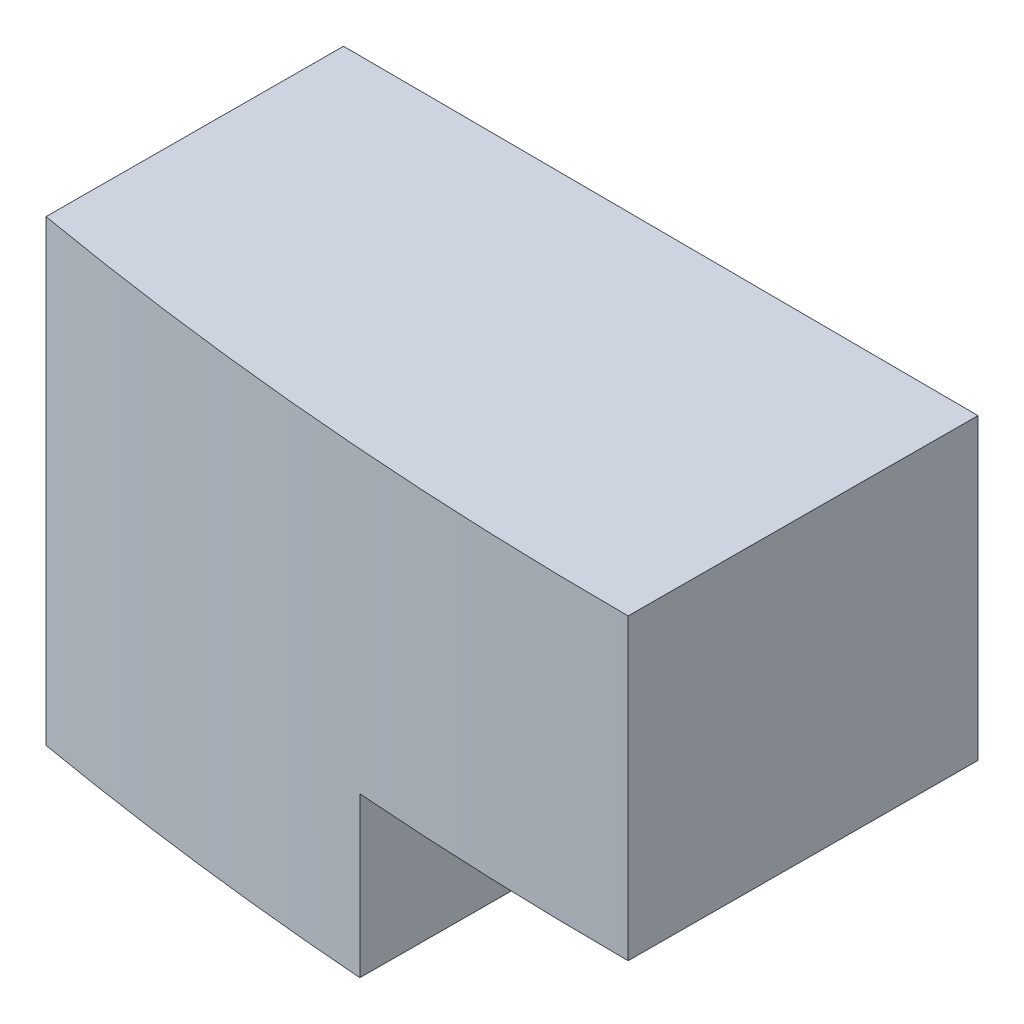
from build123d import *

# Parameters (mm, degrees)
BLOCO_DEPTH            = 9.2
ESBO_O3_W              = 5.6
ESBO_O3_H              = 3.2
RASGO_DO_ENCAIXE_DEPTH = 18.034534118


with BuildPart() as part:
    # Esboço1 → Bloco (new body)
    with BuildSketch(Plane(origin=(0, 0, 0), x_dir=(1, 0, 0), z_dir=(0, 1, 0))):
        with BuildLine():
            Line((0, -75), (0.029321703, -68))
            Line((0.029321703, -68), (-12.770566003, -67.946383642))
            Line((-12.770566003, -67.946383642), (-12.795506441, -73.900439883))
            ThreePointArc((-12.795506441, -73.900439883), (-6.421331979, -74.724604352), (0, -75))
        make_face()
    extrude(amount=BLOCO_DEPTH)

    # Esboço3 → Rasgo do Encaixe (cut, through all)
    with BuildSketch(Plane(origin=(-0.284833888, 0, 67.99868406), x_dir=(-0.9999912270311377, 0, -0.0041887779553967395), z_dir=(0.0041887779553967395, 0, -0.9999912270311377))):
        with Locations((2.485841653, 1.6)):
            Rectangle(ESBO_O3_W, ESBO_O3_H)
    extrude(amount=-RASGO_DO_ENCAIXE_DEPTH, mode=Mode.SUBTRACT)


solid = part.part
